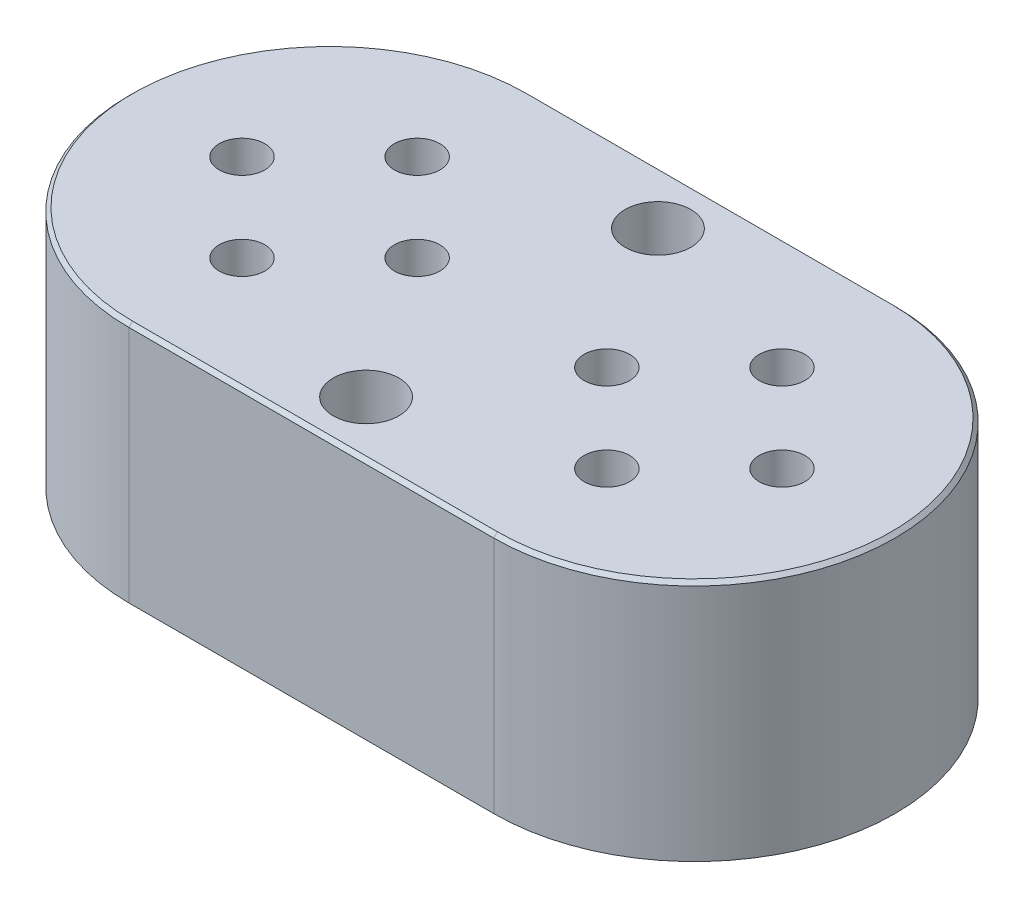
from build123d import *

# Parameters (mm, degrees)
BOSS_EXTRUDE1_DEPTH = 16.8656
CHAMFER1_SIZE       = 0.254
SKETCH3_R           = 1.5875
CUT_EXTRUDE1_DEPTH  = 16.3576
SKETCH4_R           = 2.286
CUT_EXTRUDE2_DEPTH  = 46.051151632


with BuildPart() as part:
    # Sketch1 → Boss-Extrude1 (new body)
    with BuildSketch(Plane(origin=(0, 0, 0), x_dir=(1, 0, 0), z_dir=(0, 1, 0))):
        with BuildLine():
            Line((0, 13.97), (25.4, 13.97))
            ThreePointArc((25.4, 13.97), (39.37, 0), (25.4, -13.97))
            Line((25.4, -13.97), (0, -13.97))
            ThreePointArc((0, -13.97), (-13.97, 0), (0, 13.97))
        make_face()
    extrude(amount=BOSS_EXTRUDE1_DEPTH)

    # Chamfer1
    chamfer1_edges = [part.edges().sort_by_distance(p)[0] for p in [
        (39.37, 16.8656, 0),
        (12.7, 16.8656, -13.97),
        (12.7, 16.8656, 13.97),
        (-13.97, 16.8656, 0),
    ]]
    chamfer(chamfer1_edges, length=CHAMFER1_SIZE)

    # Sketch3 → Cut-Extrude1 (cut)
    with BuildSketch(Plane(origin=(0, 16.8656, 0), x_dir=(1, 0, 0), z_dir=(0, 1, 0))):
        with Locations((25.4, 6.096)):
            Circle(SKETCH3_R)
        with Locations((31.496, 0)):
            Circle(SKETCH3_R)
        with Locations((25.4, -6.096)):
            Circle(SKETCH3_R)
        with Locations((19.304, 0)):
            Circle(SKETCH3_R)
        with Locations((-6.096, 0)):
            Circle(SKETCH3_R)
        with Locations((6.096, 0)):
            Circle(SKETCH3_R)
        with Locations((0, -6.096)):
            Circle(SKETCH3_R)
        with Locations((0, 6.096)):
            Circle(SKETCH3_R)
    extrude(amount=-CUT_EXTRUDE1_DEPTH, mode=Mode.SUBTRACT)

    # Sketch4 → Cut-Extrude2 (cut, through all)
    with BuildSketch(Plane(origin=(0, 16.8656, 0), x_dir=(1, 0, 0), z_dir=(0, 1, 0))):
        with Locations((12.7, 10.16)):
            Circle(SKETCH4_R)
        with Locations((12.7, -10.16)):
            Circle(SKETCH4_R)
    extrude(amount=-CUT_EXTRUDE2_DEPTH, mode=Mode.SUBTRACT)


solid = part.part
